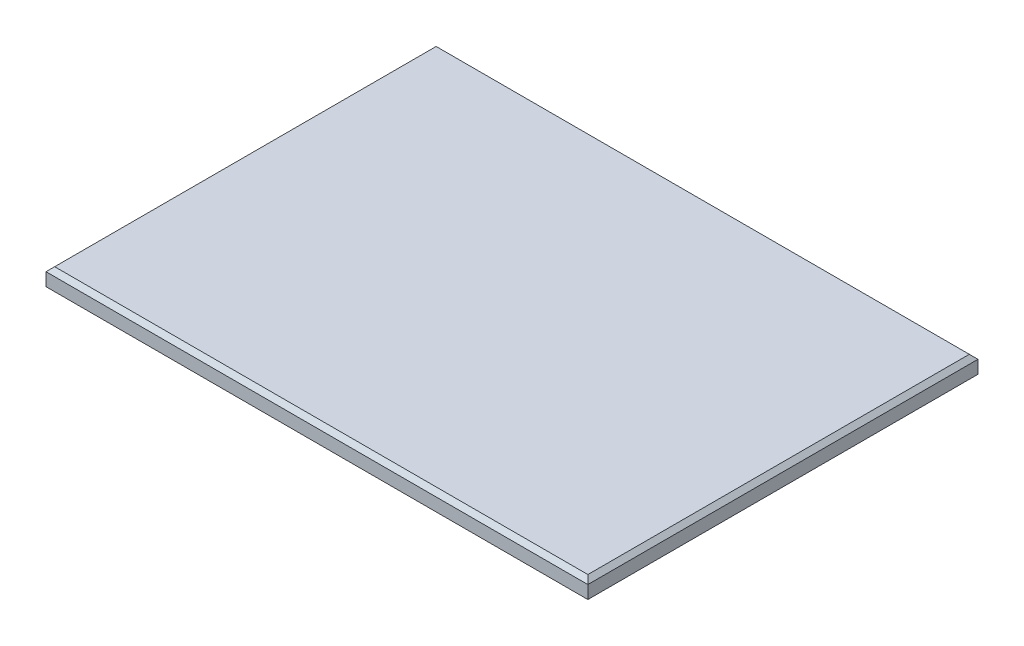
from build123d import *

# Parameters (mm, degrees)
SKETCH1_W           = 250
SKETCH1_H           = 180
BOSS_EXTRUDE1_DEPTH = 10
CHAMFER1_SIZE       = 2


with BuildPart() as part:
    # Sketch1 → Boss-Extrude1 (new body)
    with BuildSketch(Plane(origin=(0, 0, 0), x_dir=(1, 0, 0), z_dir=(0, 1, 0))):
        with Locations((125, 90)):
            Rectangle(SKETCH1_W, SKETCH1_H)
    extrude(amount=BOSS_EXTRUDE1_DEPTH)

    # Chamfer1
    chamfer1_edges = [part.edges().sort_by_distance(p)[0] for p in [
        (250, 10, -90),
        (125, 10, -180),
        (0, 10, -90),
        (125, 0, -180),
        (250, 0, -90),
        (125, 0, 0),
        (0, 0, -90),
        (125, 10, 0),
    ]]
    chamfer(chamfer1_edges, length=CHAMFER1_SIZE)


solid = part.part
